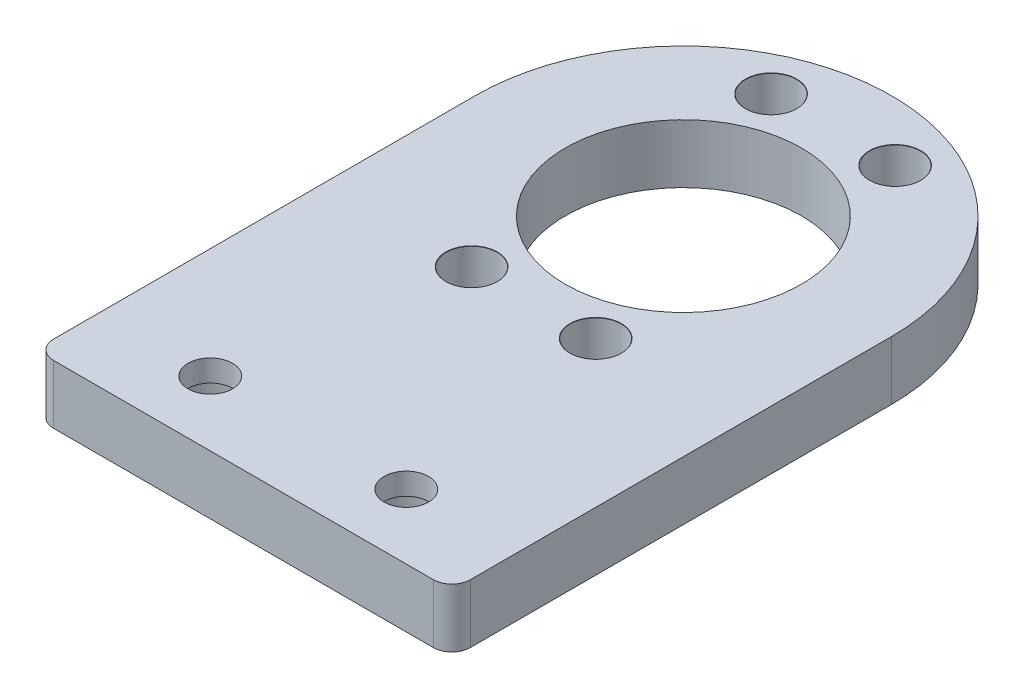
from build123d import *

# Parameters (mm, degrees)
BOSS_EXTRUDE1_DEPTH            = 6.35
M5_CLEARANCE_HOLE1_D           = 5.5
M5_CLEARANCE_HOLE1_CSINK_D     = 5.55
M5_CLEARANCE_HOLE1_CSINK_ANGLE = 90
SKETCH5_R                      = 12.75
CUT_EXTRUDE1_DEPTH             = 53.941689622
CBORE_FOR_M4_SHCS1_AT_2_COUNT  = 2
CBORE_FOR_M4_SHCS1_AT_2_PITCH  = 21.169571299
FILLET1_R                      = 2


with BuildPart() as part:
    # Sketch1 → Boss-Extrude1 (new body)
    with BuildSketch(Plane(origin=(0, 0, 0), x_dir=(1, 0, 0), z_dir=(0, 1, 0))):
        with BuildLine():
            Line((-22.5, -47.5), (22.5, -47.5))
            Line((22.5, -47.5), (22.5, 3.34e-07))
            ThreePointArc((22.5, 3.34e-07), (0, 22.5), (-22.5, 3.34e-07))
            Line((-22.5, 3.34e-07), (-22.5, -47.5))
        make_face()
    extrude(amount=BOSS_EXTRUDE1_DEPTH)

    # M5 Clearance Hole1 (through all)
    with Locations(Plane(origin=(0, 6.35, 0), x_dir=(1, 0, 0), z_dir=(0, 1, 0))):
        with Locations((-6.696960066, -16.167891819), (6.696960066, -16.167891819), (6.696960066, 16.167891819), (-6.696960066, 16.167891819)):
            CounterSinkHole(M5_CLEARANCE_HOLE1_D / 2, M5_CLEARANCE_HOLE1_CSINK_D / 2, counter_sink_angle=M5_CLEARANCE_HOLE1_CSINK_ANGLE)

    # Sketch5 → Cut-Extrude1 (cut, through all)
    with BuildSketch(Plane(origin=(0, 6.35, 0), x_dir=(1, 0, 0), z_dir=(0, 1, 0))):
        with Locations(Location((0, 0, 0), (0, 0, 270))):
            Circle(SKETCH5_R)
    extrude(amount=-CUT_EXTRUDE1_DEPTH, mode=Mode.SUBTRACT)

    # Sketch10 → CBORE for M4 SHCS1 (revolve, cut)
    with BuildSketch(Plane(origin=(10.584785649, 0, 40.5), x_dir=(0, 0, -1), z_dir=(1, 0, 0))):
        Polygon((0, 0), (0, 6.35), (2.4, 6.35), (2.4, 4), (4, 4), (4, 0.025), (4.025, 0), align=None)
    cbore_for_m4_shcs1 = revolve(axis=Axis((10.584785649, -6.35, 40.5), (0, 1, 0)), mode=Mode.SUBTRACT)

    # CBORE for M4 SHCS1 at 2: CBORE for M4 SHCS1 ×2
    with Locations(*[(-i * CBORE_FOR_M4_SHCS1_AT_2_PITCH, 0, 0) for i in range(1, CBORE_FOR_M4_SHCS1_AT_2_COUNT)]):
        add(cbore_for_m4_shcs1, mode=Mode.SUBTRACT)

    # Fillet1
    fillet1_edges = [part.edges().sort_by_distance(p)[0] for p in [
        (22.5, 3.175, 47.5),
        (-22.5, 3.175, 47.5),
    ]]
    fillet(fillet1_edges, radius=FILLET1_R)


solid = part.part
